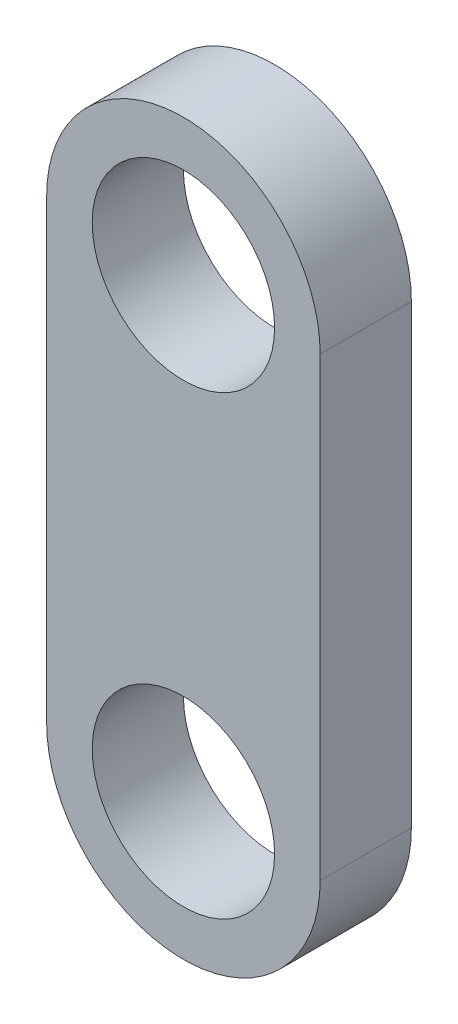
from build123d import *

# Parameters (mm, degrees)
SKETCH1_R           = 2
BOSS_EXTRUDE1_DEPTH = 2


with BuildPart() as part:
    # Sketch1 → Boss-Extrude1 (new body)
    with BuildSketch(Plane.XY):
        with BuildLine():
            Line((-3, 5), (-3, -5))
            ThreePointArc((-3, -5), (0, -8), (3, -5))
            Line((3, -5), (3, 5))
            ThreePointArc((3, 5), (0, 8), (-3, 5))
        make_face()
        with Locations((0, 5)):
            Circle(SKETCH1_R, mode=Mode.SUBTRACT)
        with Locations((0, -5)):
            Circle(SKETCH1_R, mode=Mode.SUBTRACT)
    extrude(amount=BOSS_EXTRUDE1_DEPTH)


solid = part.part
